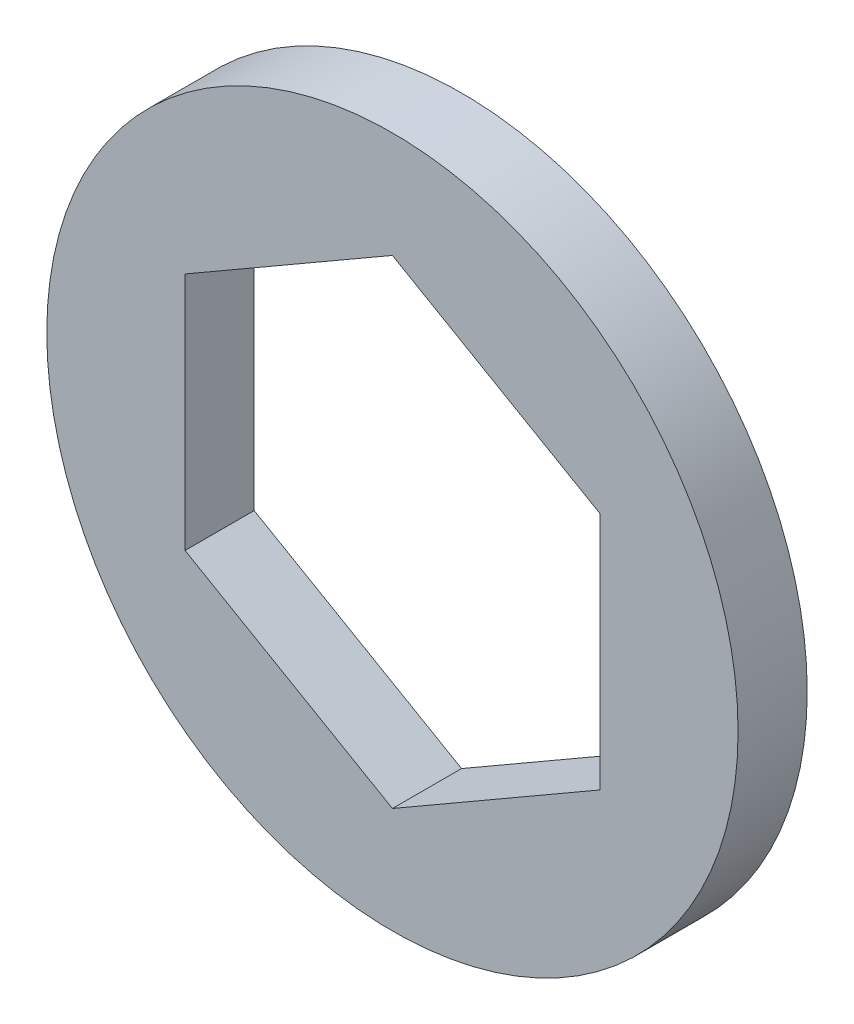
from build123d import *

# Parameters (mm, degrees)
SKETCH1_R         = 7.9375
SPACER_BOSS_DEPTH = 1.5875


with BuildPart() as part:
    # Sketch1 → Spacer Boss (new body)
    with BuildSketch(Plane.XY):
        Circle(SKETCH1_R)
        Polygon((-4.7625, 2.749630657), (-4.7625, -2.749630657), (0, -5.499261314), (4.7625, -2.749630657), (4.7625, 2.749630657), (0, 5.499261314), align=None, mode=Mode.SUBTRACT)
    extrude(amount=SPACER_BOSS_DEPTH)


solid = part.part
